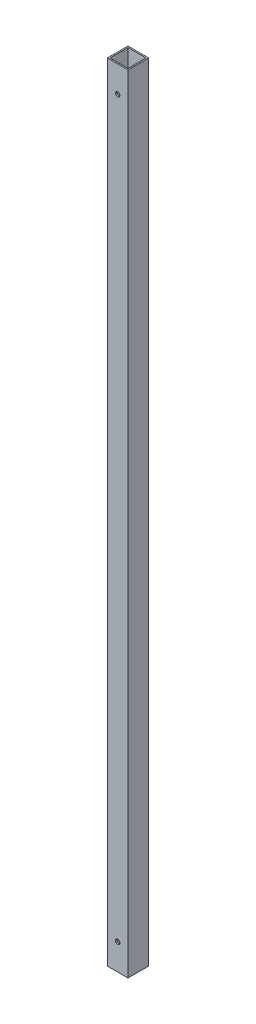
from build123d import *

# Parameters (mm, degrees)
SKETCH1_W           = 15.8
SKETCH1_H           = 15.8
SKETCH1_W_2         = 13.8
SKETCH1_H_2         = 13.8
BOSS_EXTRUDE1_DEPTH = 600
SKETCH3_R           = 1.7
CUT_EXTRUDE2_DEPTH  = 601.25998534


with BuildPart() as part:
    # Sketch1 → Boss-Extrude1 (new body)
    with BuildSketch(Plane(origin=(0, 0, 0), x_dir=(1, 0, 0), z_dir=(0, 1, 0))):
        Rectangle(SKETCH1_W, SKETCH1_H)
        Rectangle(SKETCH1_W_2, SKETCH1_H_2, mode=Mode.SUBTRACT)
    extrude(amount=BOSS_EXTRUDE1_DEPTH)

    # Sketch3 → Cut-Extrude2 (cut, through all)
    with BuildSketch(Plane.XY.offset(7.9)):
        with Locations((0, 580)):
            Circle(SKETCH3_R)
        with Locations((0, 20)):
            Circle(SKETCH3_R)
    extrude(amount=-CUT_EXTRUDE2_DEPTH, mode=Mode.SUBTRACT)


solid = part.part
